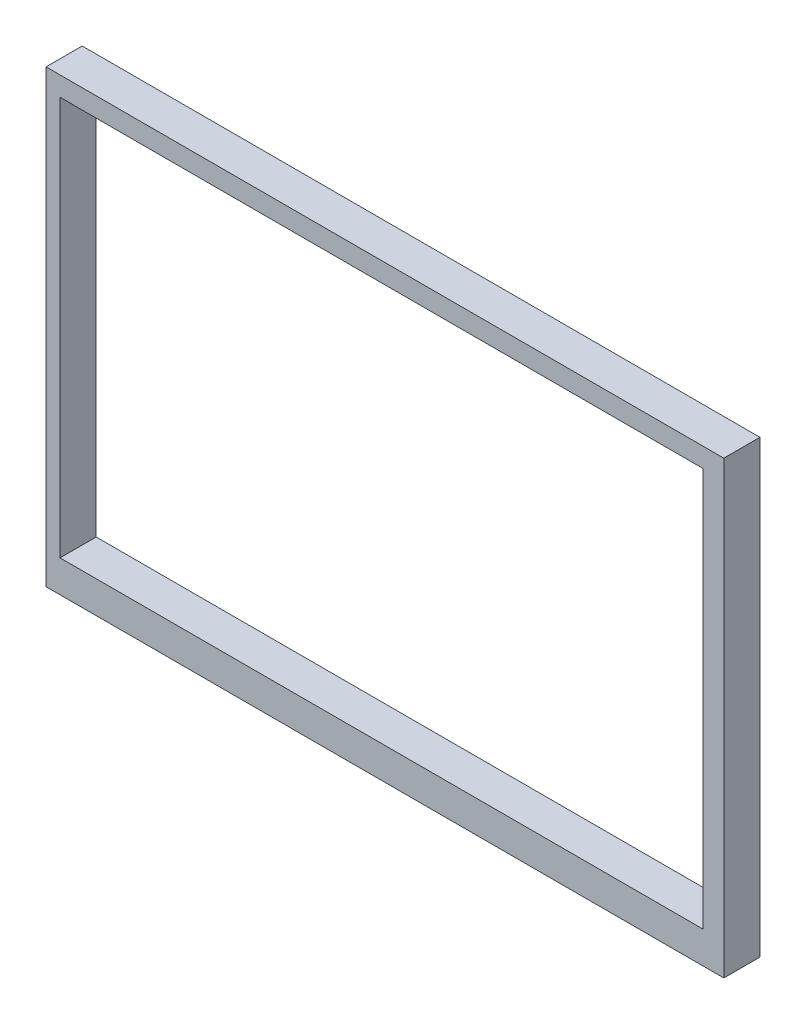
from build123d import *

# Parameters (mm, degrees)
SKETCH2_W           = 93.787005881
SKETCH2_H           = 62.301232666
SKETCH2_W_2         = 89
SKETCH2_H_2         = 55.2
BOSS_EXTRUDE1_DEPTH = 5


with BuildPart() as part:
    # Sketch2 → Boss-Extrude1 (new body)
    with BuildSketch(Plane.XY):
        with Locations((-1.802567937, 4.535053929)):
            Rectangle(SKETCH2_W, SKETCH2_H)
        with Locations((-2.263097072, 5.409244992)):
            Rectangle(SKETCH2_W_2, SKETCH2_H_2, mode=Mode.SUBTRACT)
    extrude(amount=BOSS_EXTRUDE1_DEPTH)


solid = part.part
